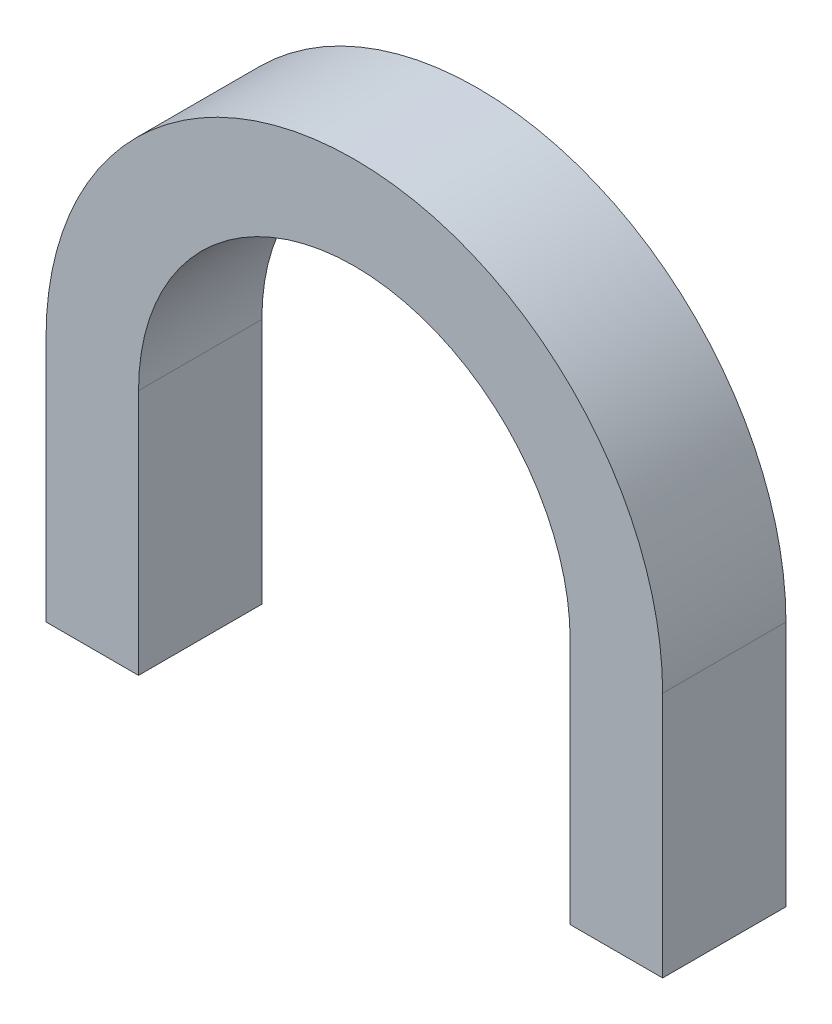
from build123d import *

# Parameters (mm, degrees)
BOSS_EXTRUDE1_DEPTH = 2


with BuildPart() as part:
    # Sketch1 → Boss-Extrude1 (new body)
    with BuildSketch(Plane.XY):
        with BuildLine():
            Line((-5, 0), (-5, 4))
            ThreePointArc((-5, 4), (0, 9), (5, 4))
            Line((5, 4), (5, 0))
            Line((5, 0), (3.5, 0))
            Line((3.5, 0), (3.5, 4))
            ThreePointArc((3.5, 4), (0, 7.5), (-3.5, 4))
            Line((-3.5, 4), (-3.5, 0))
            Line((-3.5, 0), (-5, 0))
        make_face()
    extrude(amount=BOSS_EXTRUDE1_DEPTH)


solid = part.part
